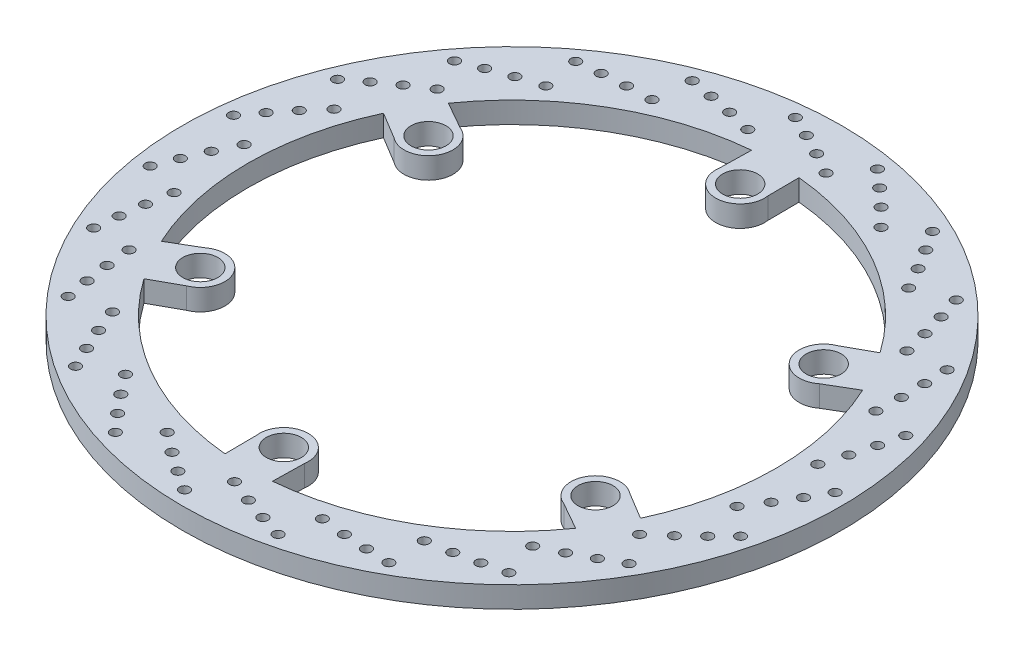
from build123d import *

# Parameters (mm, degrees)
SKETCH1_R           = 155.1
SKETCH1_R_2         = 8.225
SKETCH1_R_3         = 2.35
BOSS_EXTRUDE1_DEPTH = 10


with BuildPart() as part:
    # Sketch1 → Boss-Extrude1 (new body)
    with BuildSketch(Plane(origin=(0, 3.76, 0), x_dir=(1, 0, 0), z_dir=(0, 1, 0))):
        with Locations(Location((0, 0, 0), (0, 0, 90))):
            Circle(SKETCH1_R)
        with Locations(Location((-92.997954647, -53.69239415, 0), (0, 0, 90))):
            Circle(SKETCH1_R_2, mode=Mode.SUBTRACT)
        with Locations(Location((0, -107.3847883, 0), (0, 0, 90))):
            Circle(SKETCH1_R_2, mode=Mode.SUBTRACT)
        with Locations(Location((92.997954647, -53.69239415, 0), (0, 0, 90))):
            Circle(SKETCH1_R_2, mode=Mode.SUBTRACT)
        with Locations(Location((92.997954647, 53.69239415, 0), (0, 0, 90))):
            Circle(SKETCH1_R_2, mode=Mode.SUBTRACT)
        with Locations(Location((0, 107.3847883, 0), (0, 0, 90))):
            Circle(SKETCH1_R_2, mode=Mode.SUBTRACT)
        with Locations(Location((-92.997954647, 53.69239415, 0), (0, 0, 90))):
            Circle(SKETCH1_R_2, mode=Mode.SUBTRACT)
        with Locations(Location((-14.108570086, 147.453516591, 0), (0, 0, 90))):
            Circle(SKETCH1_R_3, mode=Mode.SUBTRACT)
        with Locations(Location((-4.23359466, 142.754245153, 0), (0, 0, 90))):
            Circle(SKETCH1_R_3, mode=Mode.SUBTRACT)
        with Locations(Location((5.663589498, 137.721286806, 0), (0, 0, 90))):
            Circle(SKETCH1_R_3, mode=Mode.SUBTRACT)
        with Locations(Location((15.772202274, 132.032177785, 0), (0, 0, 90))):
            Circle(SKETCH1_R_3, mode=Mode.SUBTRACT)
        with Locations(Location((26.197096636, 145.79198686, 0), (0, 0, 90))):
            Circle(SKETCH1_R_3, mode=Mode.SUBTRACT)
        with Locations(Location((34.438032925, 138.60274067, 0), (0, 0, 90))):
            Circle(SKETCH1_R_3, mode=Mode.SUBTRACT)
        with Locations(Location((42.610326736, 131.086189742, 0), (0, 0, 90))):
            Circle(SKETCH1_R_3, mode=Mode.SUBTRACT)
        with Locations(Location((50.809181485, 122.880777228, 0), (0, 0, 90))):
            Circle(SKETCH1_R_3, mode=Mode.SUBTRACT)
        with Locations(Location((64.559844545, 133.317732418, 0), (0, 0, 90))):
            Circle(SKETCH1_R_3, mode=Mode.SUBTRACT)
        with Locations(Location((70.555549152, 124.171704976, 0), (0, 0, 90))):
            Circle(SKETCH1_R_3, mode=Mode.SUBTRACT)
        with Locations(Location((76.39685097, 114.729029664, 0), (0, 0, 90))):
            Circle(SKETCH1_R_3, mode=Mode.SUBTRACT)
        with Locations(Location((82.077876141, 104.615871566, 0), (0, 0, 90))):
            Circle(SKETCH1_R_3, mode=Mode.SUBTRACT)
        with Locations(Location((98.134484125, 110.955911651, 0), (0, 0, 90))):
            Circle(SKETCH1_R_3, mode=Mode.SUBTRACT)
        with Locations(Location((101.440283069, 100.531421973, 0), (0, 0, 90))):
            Circle(SKETCH1_R_3, mode=Mode.SUBTRACT)
        with Locations(Location((104.517370259, 89.862942306, 0), (0, 0, 90))):
            Circle(SKETCH1_R_3, mode=Mode.SUBTRACT)
        with Locations(Location((107.259230205, 78.592085295, 0), (0, 0, 90))):
            Circle(SKETCH1_R_3, mode=Mode.SUBTRACT)
        with Locations(Location((124.430937954, 80.364998506, 0), (0, 0, 90))):
            Circle(SKETCH1_R_3, mode=Mode.SUBTRACT)
        with Locations(Location((124.801655248, 69.435183302, 0), (0, 0, 90))):
            Circle(SKETCH1_R_3, mode=Mode.SUBTRACT)
        with Locations(Location((124.886314331, 58.332131612, 0), (0, 0, 90))):
            Circle(SKETCH1_R_3, mode=Mode.SUBTRACT)
        with Locations(Location((124.485657843, 46.739483593, 0), (0, 0, 90))):
            Circle(SKETCH1_R_3, mode=Mode.SUBTRACT)
        with Locations(Location((141.498918347, 43.813781067, 0), (0, 0, 90))):
            Circle(SKETCH1_R_3, mode=Mode.SUBTRACT)
        with Locations(Location((138.907059588, 33.189254731, 0), (0, 0, 90))):
            Circle(SKETCH1_R_3, mode=Mode.SUBTRACT)
        with Locations(Location((135.993011786, 22.475093569, 0), (0, 0, 90))):
            Circle(SKETCH1_R_3, mode=Mode.SUBTRACT)
        with Locations(Location((132.479553723, 11.420428212, 0), (0, 0, 90))):
            Circle(SKETCH1_R_3, mode=Mode.SUBTRACT)
        with Locations(Location((148.072571282, 4.013095921, 0), (0, 0, 90))):
            Circle(SKETCH1_R_3, mode=Mode.SUBTRACT)
        with Locations(Location((142.710362775, -5.518169033, 0), (0, 0, 90))):
            Circle(SKETCH1_R_3, mode=Mode.SUBTRACT)
        with Locations(Location((137.013729684, -15.048819347, 0), (0, 0, 90))):
            Circle(SKETCH1_R_3, mode=Mode.SUBTRACT)
        with Locations(Location((130.648047157, -24.745628084, 0), (0, 0, 90))):
            Circle(SKETCH1_R_3, mode=Mode.SUBTRACT)
        with Locations(Location((143.664358991, -36.08522219, 0), (0, 0, 90))):
            Circle(SKETCH1_R_3, mode=Mode.SUBTRACT)
        with Locations(Location((135.929491212, -43.816335444, 0), (0, 0, 90))):
            Circle(SKETCH1_R_3, mode=Mode.SUBTRACT)
        with Locations(Location((127.872766047, -51.456630177, 0), (0, 0, 90))):
            Circle(SKETCH1_R_3, mode=Mode.SUBTRACT)
        with Locations(Location((119.126972609, -59.07641435, 0), (0, 0, 90))):
            Circle(SKETCH1_R_3, mode=Mode.SUBTRACT)
        with Locations(Location((128.601218415, -73.507264451, 0), (0, 0, 90))):
            Circle(SKETCH1_R_3, mode=Mode.SUBTRACT)
        with Locations(Location((119.067351122, -78.864844702, 0), (0, 0, 90))):
            Circle(SKETCH1_R_3, mode=Mode.SUBTRACT)
        with Locations(Location((109.248064331, -84.048138144, 0), (0, 0, 90))):
            Circle(SKETCH1_R_3, mode=Mode.SUBTRACT)
        with Locations(Location((98.770795471, -89.025773219, 0), (0, 0, 90))):
            Circle(SKETCH1_R_3, mode=Mode.SUBTRACT)
        with Locations(Location((104.00031378, -105.477609181, 0), (0, 0, 90))):
            Circle(SKETCH1_R_3, mode=Mode.SUBTRACT)
        with Locations(Location((93.374530296, -108.06430921, 0), (0, 0, 90))):
            Circle(SKETCH1_R_3, mode=Mode.SUBTRACT)
        with Locations(Location((82.520933461, -110.4061802, 0), (0, 0, 90))):
            Circle(SKETCH1_R_3, mode=Mode.SUBTRACT)
        with Locations(Location((71.08924028, -112.372497755, 0), (0, 0, 90))):
            Circle(SKETCH1_R_3, mode=Mode.SUBTRACT)
        with Locations(Location((71.686181642, -129.625162165, 0), (0, 0, 90))):
            Circle(SKETCH1_R_3, mode=Mode.SUBTRACT)
        with Locations(Location((60.756547717, -129.249138266, 0), (0, 0, 90))):
            Circle(SKETCH1_R_3, mode=Mode.SUBTRACT)
        with Locations(Location((49.673602464, -128.575900945, 0), (0, 0, 90))):
            Circle(SKETCH1_R_3, mode=Mode.SUBTRACT)
        with Locations(Location((38.135321349, -127.385068202, 0), (0, 0, 90))):
            Circle(SKETCH1_R_3, mode=Mode.SUBTRACT)
        with Locations(Location((34.055413355, -144.159009868, 0), (0, 0, 90))):
            Circle(SKETCH1_R_3, mode=Mode.SUBTRACT)
        with Locations(Location((23.632529938, -140.848150011, 0), (0, 0, 90))):
            Circle(SKETCH1_R_3, mode=Mode.SUBTRACT)
        with Locations(Location((13.142207614, -137.209735313, 0), (0, 0, 90))):
            Circle(SKETCH1_R_3, mode=Mode.SUBTRACT)
        with Locations(Location((2.353080091, -132.950070889, 0), (0, 0, 90))):
            Circle(SKETCH1_R_3, mode=Mode.SUBTRACT)
        with Locations(Location((-6.101089149, -148.001243292, 0), (0, 0, 90))):
            Circle(SKETCH1_R_3, mode=Mode.SUBTRACT)
        with Locations(Location((-15.244204476, -142.001098808, 0), (0, 0, 90))):
            Circle(SKETCH1_R_3, mode=Mode.SUBTRACT)
        with Locations(Location((-24.363884654, -135.667351305, 0), (0, 0, 90))):
            Circle(SKETCH1_R_3, mode=Mode.SUBTRACT)
        with Locations(Location((-33.603678353, -128.654775024, 0), (0, 0, 90))):
            Circle(SKETCH1_R_3, mode=Mode.SUBTRACT)
        with Locations(Location((-45.80510178, -140.866901562, 0), (0, 0, 90))):
            Circle(SKETCH1_R_3, mode=Mode.SUBTRACT)
        with Locations(Location((-52.990345981, -132.622475719, 0), (0, 0, 90))):
            Circle(SKETCH1_R_3, mode=Mode.SUBTRACT)
        with Locations(Location((-60.063019054, -124.063140488, 0), (0, 0, 90))):
            Circle(SKETCH1_R_3, mode=Mode.SUBTRACT)
        with Locations(Location((-67.0682057, -114.817743052, 0), (0, 0, 90))):
            Circle(SKETCH1_R_3, mode=Mode.SUBTRACT)
        with Locations(Location((-82.111959557, -123.285106167, 0), (0, 0, 90))):
            Circle(SKETCH1_R_3, mode=Mode.SUBTRACT)
        with Locations(Location((-86.806435939, -113.407850312, 0), (0, 0, 90))):
            Circle(SKETCH1_R_3, mode=Mode.SUBTRACT)
        with Locations(Location((-91.3075541, -103.257734092, 0), (0, 0, 90))):
            Circle(SKETCH1_R_3, mode=Mode.SUBTRACT)
        with Locations(Location((-95.558591047, -92.465204333, 0), (0, 0, 90))):
            Circle(SKETCH1_R_3, mode=Mode.SUBTRACT)
        with Locations(Location((-112.328948931, -96.559818438, 0), (0, 0, 90))):
            Circle(SKETCH1_R_3, mode=Mode.SUBTRACT)
        with Locations(Location((-114.184489657, -85.782283455, 0), (0, 0, 90))):
            Circle(SKETCH1_R_3, mode=Mode.SUBTRACT)
        with Locations(Location((-115.780225564, -74.794173931, 0), (0, 0, 90))):
            Circle(SKETCH1_R_3, mode=Mode.SUBTRACT)
        with Locations(Location((-116.961832847, -63.25494441, 0), (0, 0, 90))):
            Circle(SKETCH1_R_3, mode=Mode.SUBTRACT)
        with Locations(Location((-134.215014034, -62.673130708, 0), (0, 0, 90))):
            Circle(SKETCH1_R_3, mode=Mode.SUBTRACT)
        with Locations(Location((-133.094002136, -51.794637061, 0), (0, 0, 90))):
            Circle(SKETCH1_R_3, mode=Mode.SUBTRACT)
        with Locations(Location((-131.666007356, -40.78347205, 0), (0, 0, 90))):
            Circle(SKETCH1_R_3, mode=Mode.SUBTRACT)
        with Locations(Location((-129.69055057, -29.353354632, 0), (0, 0, 90))):
            Circle(SKETCH1_R_3, mode=Mode.SUBTRACT)
        with Locations(Location((-146.146965538, -24.138263584, 0), (0, 0, 90))):
            Circle(SKETCH1_R_3, mode=Mode.SUBTRACT)
        with Locations(Location((-142.132541342, -13.965619381, 0), (0, 0, 90))):
            Circle(SKETCH1_R_3, mode=Mode.SUBTRACT)
        with Locations(Location((-137.786723715, -3.748046619, 0), (0, 0, 90))):
            Circle(SKETCH1_R_3, mode=Mode.SUBTRACT)
        with Locations(Location((-132.800713452, 6.725239177, 0), (0, 0, 90))):
            Circle(SKETCH1_R_3, mode=Mode.SUBTRACT)
        with Locations(Location((-147.239865186, 16.186828125, 0), (0, 0, 90))):
            Circle(SKETCH1_R_3, mode=Mode.SUBTRACT)
        with Locations(Location((-140.629760169, 24.8991644, 0), (0, 0, 90))):
            Circle(SKETCH1_R_3, mode=Mode.SUBTRACT)
        with Locations(Location((-133.688429108, 33.565354283, 0), (0, 0, 90))):
            Circle(SKETCH1_R_3, mode=Mode.SUBTRACT)
        with Locations(Location((-126.06165494, 42.305052761, 0), (0, 0, 90))):
            Circle(SKETCH1_R_3, mode=Mode.SUBTRACT)
        with Locations(Location((-137.412657611, 55.311416842, 0), (0, 0, 90))):
            Circle(SKETCH1_R_3, mode=Mode.SUBTRACT)
        with Locations(Location((-128.697113022, 61.917291063, 0), (0, 0, 90))):
            Circle(SKETCH1_R_3, mode=Mode.SUBTRACT)
        with Locations(Location((-119.675075299, 68.38936641, 0), (0, 0, 90))):
            Circle(SKETCH1_R_3, mode=Mode.SUBTRACT)
        with Locations(Location((-109.973180174, 74.747294116, 0), (0, 0, 90))):
            Circle(SKETCH1_R_3, mode=Mode.SUBTRACT)
        with Locations(Location((-117.394181842, 90.333810804, 0), (0, 0, 90))):
            Circle(SKETCH1_R_3, mode=Mode.SUBTRACT)
        with Locations(Location((-107.219589753, 94.343295501, 0), (0, 0, 90))):
            Circle(SKETCH1_R_3, mode=Mode.SUBTRACT)
        with Locations(Location((-96.785968631, 98.14125209, 0), (0, 0, 90))):
            Circle(SKETCH1_R_3, mode=Mode.SUBTRACT)
        with Locations(Location((-85.728497729, 101.645870611, 0), (0, 0, 90))):
            Circle(SKETCH1_R_3, mode=Mode.SUBTRACT)
        with Locations(Location((-88.669116649, 118.656559269, 0), (0, 0, 90))):
            Circle(SKETCH1_R_3, mode=Mode.SUBTRACT)
        with Locations(Location((-77.790080009, 119.772289304, 0), (0, 0, 90))):
            Circle(SKETCH1_R_3, mode=Mode.SUBTRACT)
        with Locations(Location((-66.718689436, 120.614450069, 0), (0, 0, 90))):
            Circle(SKETCH1_R_3, mode=Mode.SUBTRACT)
        with Locations(Location((-55.12572479, 121.005837883, 0), (0, 0, 90))):
            Circle(SKETCH1_R_3, mode=Mode.SUBTRACT)
        with Locations(Location((-53.367868707, 138.179093551, 0), (0, 0, 90))):
            Circle(SKETCH1_R_3, mode=Mode.SUBTRACT)
        with Locations(Location((-42.591235897, 136.31832033, 0), (0, 0, 90))):
            Circle(SKETCH1_R_3, mode=Mode.SUBTRACT)
        with Locations(Location((-31.703190264, 134.142226062, 0), (0, 0, 90))):
            Circle(SKETCH1_R_3, mode=Mode.SUBTRACT)
        with Locations(Location((-20.434529026, 131.391355723, 0), (0, 0, 90))):
            Circle(SKETCH1_R_3, mode=Mode.SUBTRACT)
        with BuildLine():
            Line((-100.11647971, -44.66041757), (-112.853215519, -52.157784257))
            ThreePointArc((-112.853215519, -52.157784257), (-124.323272454, 0.08147429), (-112.784756217, 52.305654348))
            Line((-112.784756217, 52.305654348), (-100.11647971, 44.66041757))
            ThreePointArc((-100.11647971, 44.66041757), (-83.038662504, 47.94239415), (-88.735296015, 64.373205981))
            Line((-88.735296015, 64.373205981), (-101.596573932, 71.65485941))
            ThreePointArc((-101.596573932, 71.65485941), (-62.091077422, 107.707849372), (-11.094352681, 123.827291218))
            Line((-11.094352681, 123.827291218), (-11.381183696, 109.033623552))
            ThreePointArc((-11.381183696, 109.033623552), (0, 95.8847883), (11.381183696, 109.033623552))
            Line((11.381183696, 109.033623552), (11.256641588, 123.812643667))
            ThreePointArc((11.256641588, 123.812643667), (62.232195032, 107.626375082), (101.690403536, 71.521636869))
            Line((101.690403536, 71.521636869), (88.735296015, 64.373205981))
            ThreePointArc((88.735296015, 64.373205981), (83.038662504, 47.94239415), (100.11647971, 44.66041757))
            Line((100.11647971, 44.66041757), (112.853215519, 52.157784258))
            ThreePointArc((112.853215519, 52.157784258), (124.323272454, -0.08147429), (112.784756217, -52.305654348))
            Line((112.784756217, -52.305654348), (100.11647971, -44.66041757))
            ThreePointArc((100.11647971, -44.66041757), (83.038662504, -47.94239415), (88.735296015, -64.373205981))
            Line((88.735296015, -64.373205981), (101.596573932, -71.65485941))
            ThreePointArc((101.596573932, -71.65485941), (62.091077422, -107.707849372), (11.094352681, -123.827291218))
            Line((11.094352681, -123.827291218), (11.381183696, -109.033623552))
            ThreePointArc((11.381183696, -109.033623552), (0, -95.8847883), (-11.381183696, -109.033623552))
            Line((-11.381183696, -109.033623552), (-11.256641588, -123.812643667))
            ThreePointArc((-11.256641588, -123.812643667), (-62.232195032, -107.626375082), (-101.690403536, -71.521636869))
            Line((-101.690403536, -71.521636869), (-88.735296015, -64.373205981))
            ThreePointArc((-88.735296015, -64.373205981), (-83.038662504, -47.94239415), (-100.11647971, -44.66041757))
        make_face(mode=Mode.SUBTRACT)
    extrude(amount=-BOSS_EXTRUDE1_DEPTH)


solid = part.part
